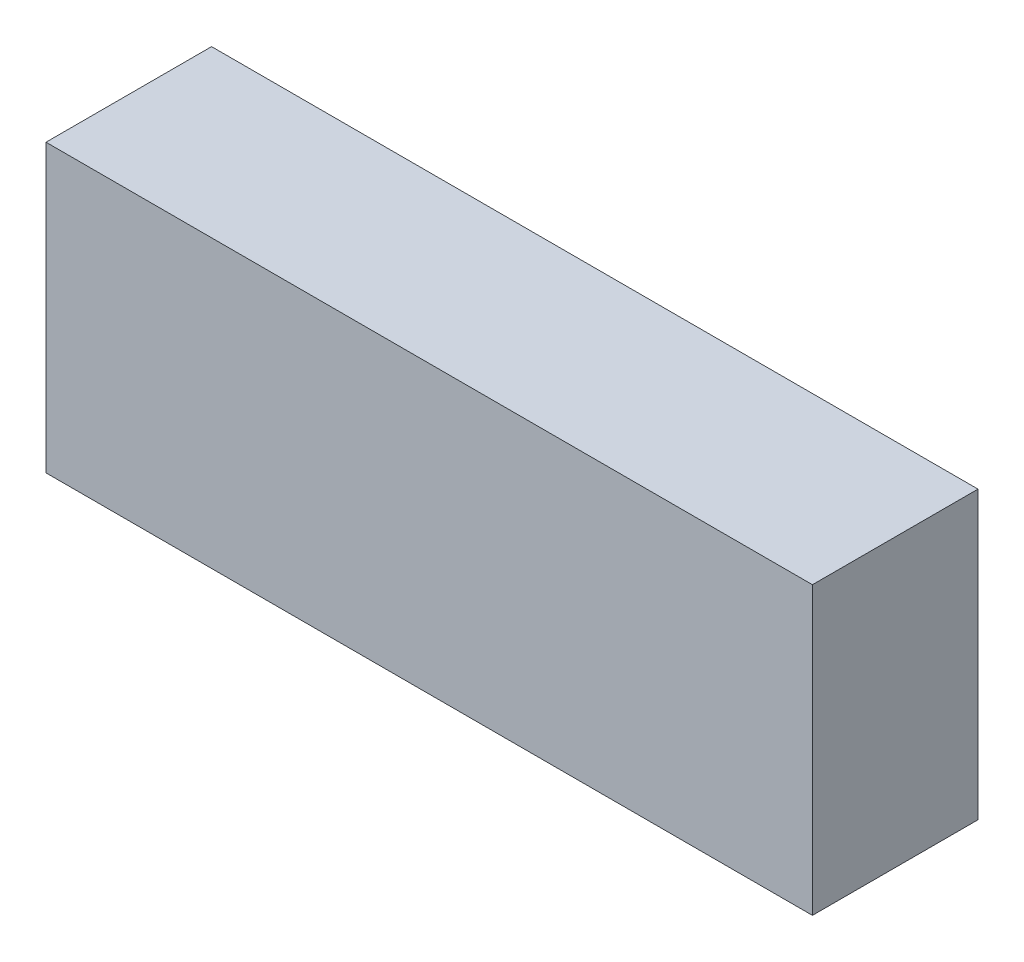
from build123d import *

# Parameters (mm, degrees)
SKETCH1_W                 = 33.56
SKETCH1_H                 = 12.54
BOSS_EXTRUDE1_DEPTH       = 7.25
SHELL1_T                  = -0.5
SHELL1_THICKNESS_2_FACE_W = 32.56
SHELL1_THICKNESS_2_FACE_H = 11.54
SHELL1_THICKNESS_2_DEPTH  = 0.3


with BuildPart() as part:
    # Sketch1 → Boss-Extrude1 (new body)
    with BuildSketch(Plane.XY):
        with Locations((0.0045, 7.98)):
            Rectangle(SKETCH1_W, SKETCH1_H)
    extrude(amount=BOSS_EXTRUDE1_DEPTH)

    # Shell1
    shell1_openings = [part.faces().sort_by_distance(p)[0] for p in [
        (0.0045, 7.98, 0),
    ]]
    offset(amount=SHELL1_T, openings=shell1_openings, kind=Kind.INTERSECTION)

    # Shell1 thickness 2 face (on inner face of the shell) → Shell1 thickness 2 (cut)
    with BuildSketch(Plane(origin=(0.0045, 7.98, 6.75), x_dir=(1, 0, 0), z_dir=(0, 0, 1))):
        Rectangle(SHELL1_THICKNESS_2_FACE_W, SHELL1_THICKNESS_2_FACE_H)
    extrude(amount=SHELL1_THICKNESS_2_DEPTH, mode=Mode.SUBTRACT)


solid = part.part
